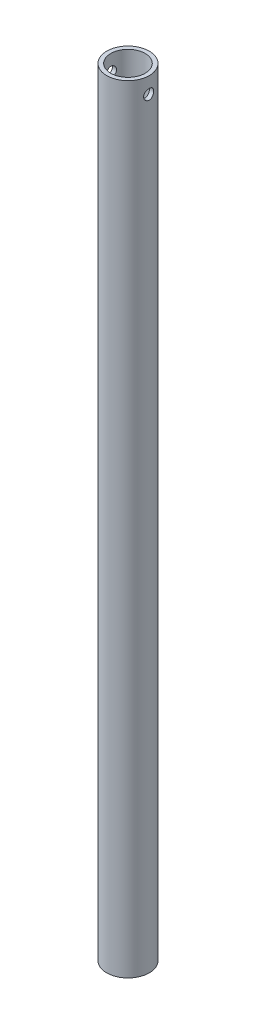
from build123d import *

# Parameters (mm, degrees)
SKETCH1_R               = 16.66875
SKETCH1_R_2             = 13.49375
BOSS_EXTRUDE1_DEPTH     = 609.6
CUT_EXTRUDE1_DEPTH      = 25.4
CUT_EXTRUDE1_DEPTH_BACK = 25.4
SKETCH2_R               = 3.96875


with BuildPart() as part:
    # Sketch1 → Boss-Extrude1 (new body)
    with BuildSketch(Plane(origin=(0, 0, 0), x_dir=(1, 0, 0), z_dir=(0, 1, 0))):
        Circle(SKETCH1_R)
        Circle(SKETCH1_R_2, mode=Mode.SUBTRACT)
    extrude(amount=BOSS_EXTRUDE1_DEPTH)

    # Sketch2 → Cut-Extrude1 (cut, two sides: drawn at the far end of the back side and taken through both)
    with BuildSketch(Plane(origin=(0, 0, 0), x_dir=(0, 0, -1), z_dir=(1, 0, 0)).offset(-CUT_EXTRUDE1_DEPTH_BACK)):
        with Locations((0, 596.9)):
            Circle(SKETCH2_R)
    extrude(amount=CUT_EXTRUDE1_DEPTH + CUT_EXTRUDE1_DEPTH_BACK, mode=Mode.SUBTRACT)


solid = part.part
